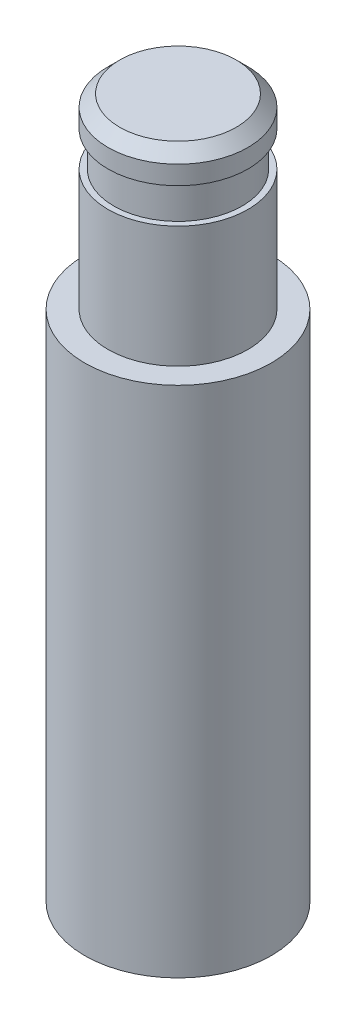
from build123d import *

# Parameters (mm, degrees)
SKETCH_1_R          = 4
EXTRUDE_1_DEPTH     = 11
SKETCH_2_R          = 3
EXTRUDE_2_DEPTH     = 8
CUT_EXTRUDE_START   = 5.2
SKETCH_3_OUTSIDE_W  = 16.412
SKETCH_3_OUTSIDE_H  = 16.412
SKETCH_3_OUTSIDE_R  = 2.75
CUT_EXTRUDE_1_DEPTH = 1.5
CHAMFER_1_SIZE      = 0.5


with BuildPart() as part:
    # 草图1 → 凸台-拉伸1 (new, symmetric)
    with BuildSketch(Plane(origin=(0, 0, 0), x_dir=(1, 0, 0), z_dir=(0, 1, 0))):
        with Locations(Location((0, 0, 0), (0, 0, 270))):
            Circle(SKETCH_1_R)
    extrude(amount=EXTRUDE_1_DEPTH, both=True)

    # 草图2 → 凸台-拉伸2 (add)
    with BuildSketch(Plane(origin=(0, 11, 0), x_dir=(1, 0, 0), z_dir=(0, 1, 0))):
        with Locations(Location((0, 0, 0), (0, 0, 270))):
            Circle(SKETCH_2_R)
    extrude(amount=EXTRUDE_2_DEPTH)

    # 草图3 outside → 切除-拉伸1 (cut)
    with BuildSketch(Plane(origin=(0, 11, 0), x_dir=(1, 0, 0), z_dir=(0, 1, 0)).offset(CUT_EXTRUDE_START)):
        Rectangle(SKETCH_3_OUTSIDE_W, SKETCH_3_OUTSIDE_H)
        with Locations(Location((0, 0, 0), (0, 0, 270))):
            Circle(SKETCH_3_OUTSIDE_R, mode=Mode.SUBTRACT)
    extrude(amount=CUT_EXTRUDE_1_DEPTH, mode=Mode.SUBTRACT)

    # 倒角1
    chamfer_1_edges = [part.edges().sort_by_distance(p)[0] for p in [
        (0, 19, -3),
    ]]
    chamfer(chamfer_1_edges, length=CHAMFER_1_SIZE)


solid = part.part
